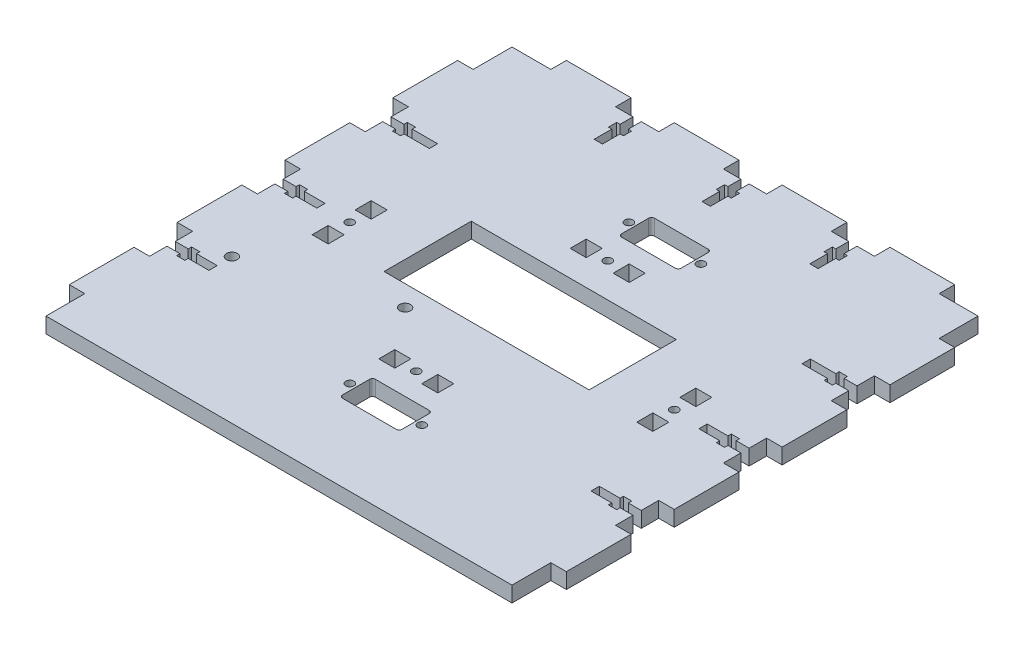
from build123d import *

# Parameters (mm, degrees)
SKETCH1_R           = 1.6
SKETCH1_R_2         = 2.1
SKETCH1_W           = 6.2
SKETCH1_H           = 6.2
SKETCH1_W_2         = 79.2
SKETCH1_H_2         = 33.683666667
BOSS_EXTRUDE1_DEPTH = 6


with BuildPart() as part:
    # Sketch1 → Boss-Extrude1 (new body)
    with BuildSketch(Plane(origin=(0, 0, 0), x_dir=(1, 0, 0), z_dir=(0, 1, 0))):
        Polygon((85, 43.266666667), (90, 43.266666667), (90, 50), (96, 50), (96, 75), (90, 75), (90, 90), (75, 90), (75, 96), (50, 96), (50, 90), (43.266666667, 90), (43.266666667, 85), (44.566666667, 85), (44.566666667, 81.8), (43.266666667, 81.8), (43.266666667, 75), (40.066666667, 75), (40.066666667, 81.8), (38.766666667, 81.8), (38.766666667, 85), (40.066666667, 85), (40.066666667, 90), (33.333333333, 90), (33.333333333, 96), (8.333333333, 96), (8.333333333, 90), (1.6, 90), (1.6, 85), (2.9, 85), (2.9, 81.8), (1.6, 81.8), (1.6, 75), (-1.6, 75), (-1.6, 81.8), (-2.9, 81.8), (-2.9, 85), (-1.6, 85), (-1.6, 90), (-8.333333333, 90), (-8.333333333, 96), (-33.333333333, 96), (-33.333333333, 90), (-40.066666667, 90), (-40.066666667, 85), (-38.766666667, 85), (-38.766666667, 81.8), (-40.066666667, 81.8), (-40.066666667, 75), (-43.266666667, 75), (-43.266666667, 81.8), (-44.566666667, 81.8), (-44.566666667, 85), (-43.266666667, 85), (-43.266666667, 90), (-50, 90), (-50, 96), (-75, 96), (-75, 90), (-90, 90), (-90, 75), (-96, 75), (-96, 50), (-90, 50), (-90, 43.266666667), (-85, 43.266666667), (-85, 44.566666667), (-81.8, 44.566666667), (-81.8, 43.266666667), (-72, 43.266666667), (-72, 40.066666667), (-81.8, 40.066666667), (-81.8, 38.766666667), (-85, 38.766666667), (-85, 40.066666667), (-90, 40.066666667), (-90, 33.333333333), (-96, 33.333333333), (-96, 8.333333333), (-90, 8.333333333), (-90, 1.6), (-85, 1.6), (-85, 2.9), (-81.8, 2.9), (-81.8, 1.6), (-73.8, 1.6), (-73.8, -1.6), (-81.8, -1.6), (-81.8, -2.9), (-85, -2.9), (-85, -1.6), (-90, -1.6), (-90, -8.333333333), (-96, -8.333333333), (-96, -33.333333333), (-90, -33.333333333), (-90, -40.066666667), (-85, -40.066666667), (-85, -38.766666667), (-81.8, -38.766666667), (-81.8, -40.066666667), (-73.8, -40.066666667), (-73.8, -43.266666667), (-81.8, -43.266666667), (-81.8, -44.566666667), (-85, -44.566666667), (-85, -43.266666667), (-90, -43.266666667), (-90, -50), (-96, -50), (-96, -75), (-90, -75), (-90, -90), (90, -90), (90, -75), (96, -75), (96, -50), (90, -50), (90, -43.266666667), (85, -43.266666667), (85, -44.566666667), (81.8, -44.566666667), (81.8, -43.266666667), (73.8, -43.266666667), (73.8, -40.066666667), (81.8, -40.066666667), (81.8, -38.766666667), (85, -38.766666667), (85, -40.066666667), (90, -40.066666667), (90, -33.333333333), (96, -33.333333333), (96, -8.333333333), (90, -8.333333333), (90, -1.6), (85, -1.6), (85, -2.9), (81.8, -2.9), (81.8, -1.6), (73.8, -1.6), (73.8, 1.6), (81.8, 1.6), (81.8, 2.9), (85, 2.9), (85, 1.6), (90, 1.6), (90, 8.333333333), (96, 8.333333333), (96, 33.333333333), (90, 33.333333333), (90, 40.066666667), (85, 40.066666667), (85, 38.766666667), (81.8, 38.766666667), (81.8, 40.066666667), (72, 40.066666667), (72, 43.266666667), (81.8, 43.266666667), (81.8, 44.566666667), (85, 44.566666667), align=None)
        with Locations((-8.75, -53.9)):
            Circle(SKETCH1_R, mode=Mode.SUBTRACT)
        with Locations((-74.006, -34.2)):
            Circle(SKETCH1_R_2, mode=Mode.SUBTRACT)
        with Locations((-62.7, -8.3)):
            Rectangle(SKETCH1_W, SKETCH1_H, mode=Mode.SUBTRACT)
        with Locations((-62.7, 0)):
            Circle(SKETCH1_R, mode=Mode.SUBTRACT)
        with Locations((-8.3, -36.966666667)):
            Rectangle(SKETCH1_W, SKETCH1_H, mode=Mode.SUBTRACT)
        with Locations((0, -36.966666667)):
            Circle(SKETCH1_R, mode=Mode.SUBTRACT)
        with Locations((-23.46, -17.817)):
            Circle(SKETCH1_R_2, mode=Mode.SUBTRACT)
        with BuildLine():
            ThreePointArc((-5.25, -60.25), (-6.027817459, -59.927817459), (-6.35, -59.15))
            Line((-6.35, -59.15), (-6.35, -48.65))
            ThreePointArc((-6.35, -48.65), (-6.027817459, -47.872182541), (-5.25, -47.55))
            Line((-5.25, -47.55), (15.55, -47.55))
            ThreePointArc((15.55, -47.55), (16.327817459, -47.872182541), (16.65, -48.65))
            Line((16.65, -48.65), (16.65, -59.15))
            ThreePointArc((16.65, -59.15), (16.327817459, -59.927817459), (15.55, -60.25))
            Line((15.55, -60.25), (-5.25, -60.25))
        make_face(mode=Mode.SUBTRACT)
        with Locations((19.05, -53.9)):
            Circle(SKETCH1_R, mode=Mode.SUBTRACT)
        with Locations((8.3, -36.966666667)):
            Rectangle(SKETCH1_W, SKETCH1_H, mode=Mode.SUBTRACT)
        with Locations((62.7, -8.3)):
            Rectangle(SKETCH1_W, SKETCH1_H, mode=Mode.SUBTRACT)
        with Locations((62.7, 0)):
            Circle(SKETCH1_R, mode=Mode.SUBTRACT)
        with Locations((-62.7, 8.3)):
            Rectangle(SKETCH1_W, SKETCH1_H, mode=Mode.SUBTRACT)
        with Locations((0, 7.024833334)):
            Rectangle(SKETCH1_W_2, SKETCH1_H_2, mode=Mode.SUBTRACT)
        with Locations((-8.3, 36.966666667)):
            Rectangle(SKETCH1_W, SKETCH1_H, mode=Mode.SUBTRACT)
        with Locations((0, 36.966666667)):
            Circle(SKETCH1_R, mode=Mode.SUBTRACT)
        with Locations((-8.75, 53.9)):
            Circle(SKETCH1_R, mode=Mode.SUBTRACT)
        with Locations((8.3, 36.966666667)):
            Rectangle(SKETCH1_W, SKETCH1_H, mode=Mode.SUBTRACT)
        with Locations((62.7, 8.3)):
            Rectangle(SKETCH1_W, SKETCH1_H, mode=Mode.SUBTRACT)
        with BuildLine():
            Line((16.65, 59.15), (16.65, 48.65))
            ThreePointArc((16.65, 48.65), (16.327817459, 47.872182541), (15.55, 47.55))
            Line((15.55, 47.55), (-5.25, 47.55))
            ThreePointArc((-5.25, 47.55), (-6.027817459, 47.872182541), (-6.35, 48.65))
            Line((-6.35, 48.65), (-6.35, 59.15))
            ThreePointArc((-6.35, 59.15), (-6.027817459, 59.927817459), (-5.25, 60.25))
            Line((-5.25, 60.25), (15.55, 60.25))
            ThreePointArc((15.55, 60.25), (16.327817459, 59.927817459), (16.65, 59.15))
        make_face(mode=Mode.SUBTRACT)
        with Locations((19.05, 53.9)):
            Circle(SKETCH1_R, mode=Mode.SUBTRACT)
    extrude(amount=BOSS_EXTRUDE1_DEPTH)


solid = part.part
